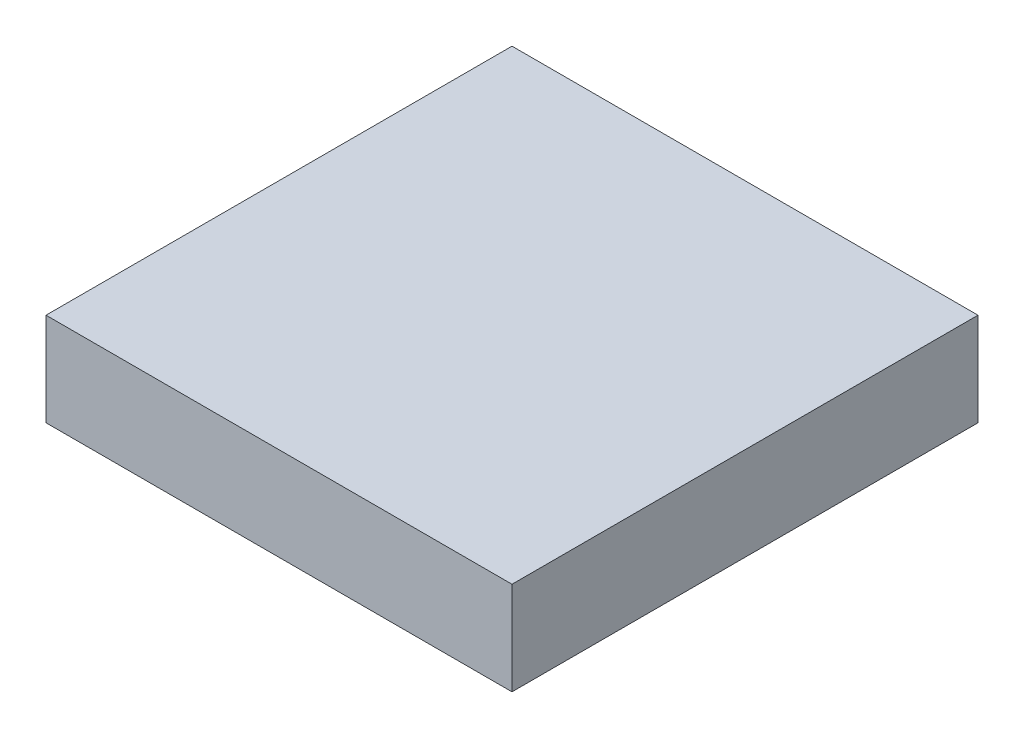
from build123d import *

# Parameters (mm, degrees)
SKETCH_1_W      = 100000
SKETCH_1_H      = 100000
EXTRUDE_1_DEPTH = 20000


with BuildPart() as part:
    # 草圖1 → 填料-伸長1 (new body)
    with BuildSketch(Plane(origin=(0, 0, 0), x_dir=(1, 0, 0), z_dir=(0, 1, 0))):
        Rectangle(SKETCH_1_W, SKETCH_1_H)
    extrude(amount=EXTRUDE_1_DEPTH)


solid = part.part
